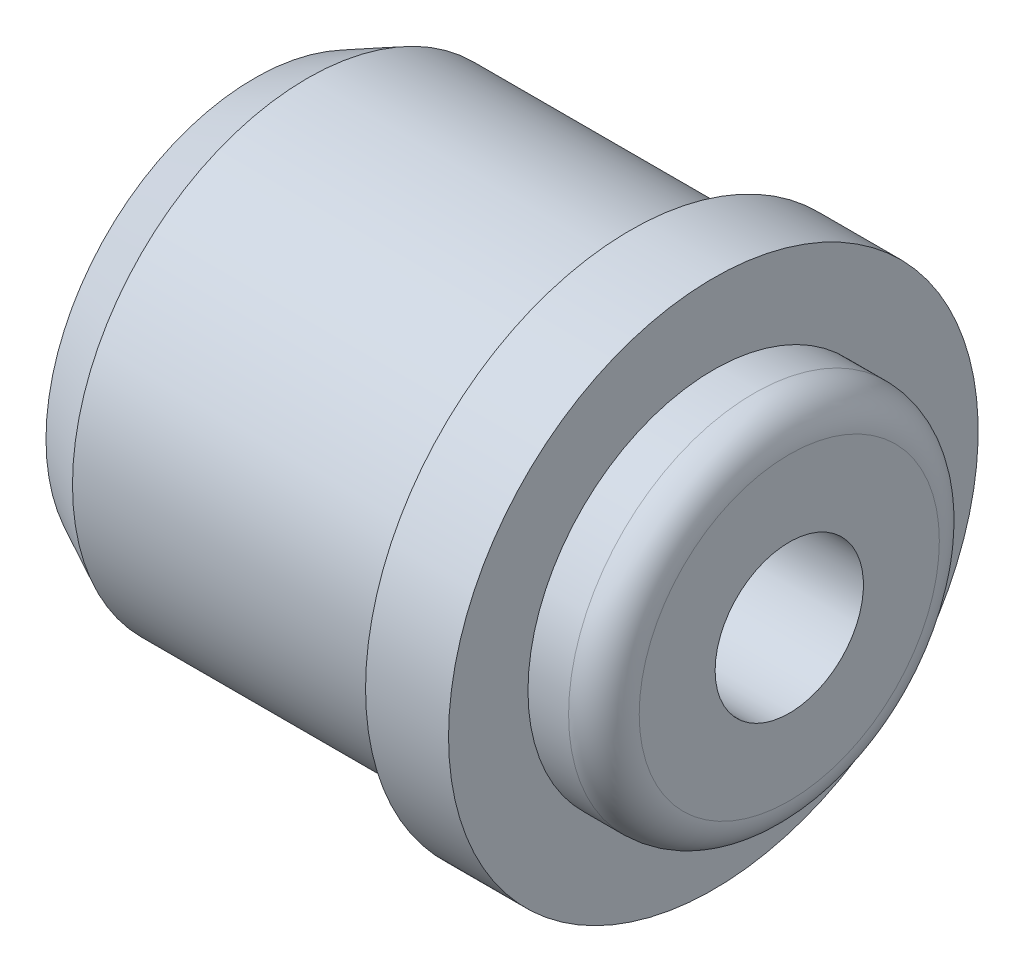
from build123d import *

# Parameters (mm, degrees)
CONG_1_R = 2


with BuildPart() as part:
    # Esquisse1 → Révolution1 (revolve)
    with BuildSketch(Plane.XY):
        Polygon((-30.3, 11.3), (-30.3, 11.8), (-27.3, 13.3), (-9, 13.3), (-9, 15), (-4.3, 15), (-4.3, 10.5), (0, 10.5), (0, 4.2), (-25.3, 4.2), (-25.3, 5.7), (-23.8, 7.2), (-20.8, 7.2), (-20.8, 8.75), (-6.3, 8.75), (-6.3, 11.3), align=None)
    revolve(axis=Axis((-62.970585652, 0, 0), (1, 0, 0)))

    # Congé1
    cong_1_edges = [part.edges().sort_by_distance(p)[0] for p in [
        (0, -10.5, 0),
    ]]
    fillet(cong_1_edges, radius=CONG_1_R)


solid = part.part
